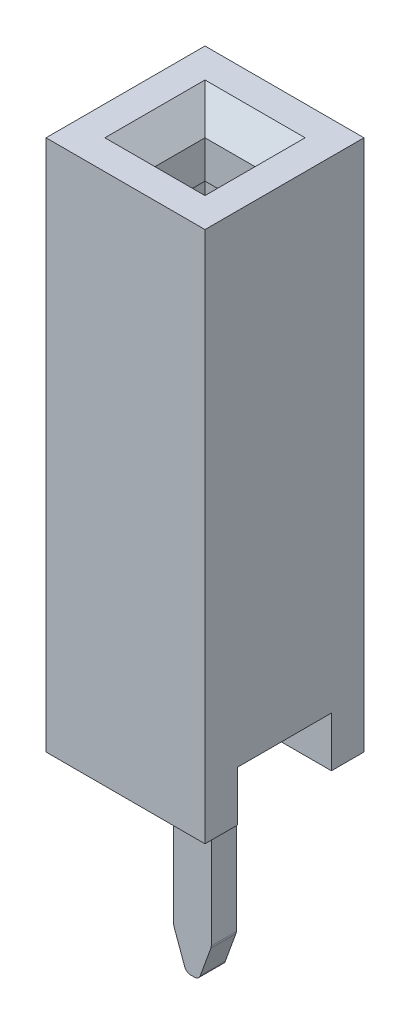
from build123d import *

# Parameters (mm, degrees)
SKETCH3_W           = 2.54
SKETCH3_H           = 2.54
SKETCH3_W_2         = 0.6
SKETCH3_H_2         = 0.4
BOSS_EXTRUDE1_DEPTH = 8.5
SKETCH4_W           = 0.8
SKETCH4_H           = 0.8
CUT_EXTRUDE1_DEPTH  = 7.5
CHAMFER1_SIZE       = 0.4
CUT_EXTRUDE3_START  = -1
SKETCH5_W           = 1.6
SKETCH5_H           = 1.6
CUT_EXTRUDE3_DEPTH  = 6.5
SKETCH6_W           = 2.54
SKETCH6_H           = 1.5
CUT_EXTRUDE4_DEPTH  = 0.8
BOSS_EXTRUDE2_START = 1
SKETCH7_W           = 0.6
SKETCH7_H           = 0.4
BOSS_EXTRUDE2_DEPTH = 4
CHAMFER2_SIZE       = 0.2
CHAMFER2_SIZE2      = 0.549495484
FILLET1_R           = 0.1


with BuildPart() as part:
    # Sketch3 → Boss-Extrude1 (new body)
    with BuildSketch(Plane(origin=(0, 0, 0), x_dir=(1, 0, 0), z_dir=(0, 1, 0))):
        Rectangle(SKETCH3_W, SKETCH3_H)
        Rectangle(SKETCH3_W_2, SKETCH3_H_2, mode=Mode.SUBTRACT)
    extrude(amount=BOSS_EXTRUDE1_DEPTH)

    # Sketch4 → Cut-Extrude1 (cut)
    with BuildSketch(Plane(origin=(0, 8.5, 0), x_dir=(1, 0, 0), z_dir=(0, 1, 0))):
        Rectangle(SKETCH4_W, SKETCH4_H)
    extrude(amount=-CUT_EXTRUDE1_DEPTH, mode=Mode.SUBTRACT)

    # Chamfer1
    chamfer1_edges = [part.edges().sort_by_distance(p)[0] for p in [
        (0.4, 8.5, 0),
        (0, 8.5, -0.4),
        (-0.4, 8.5, 0),
        (0, 8.5, 0.4),
    ]]
    chamfer(chamfer1_edges, length=CHAMFER1_SIZE)

    # Sketch5 → Cut-Extrude3 (cut)
    with BuildSketch(Plane(origin=(0, 8.5, 0), x_dir=(1, 0, 0), z_dir=(0, 1, 0)).offset(CUT_EXTRUDE3_START)):
        Rectangle(SKETCH5_W, SKETCH5_H)
    extrude(amount=-CUT_EXTRUDE3_DEPTH, mode=Mode.SUBTRACT)

    # Sketch6 → Cut-Extrude4 (cut)
    with BuildSketch(Plane.XZ):
        Rectangle(SKETCH6_W, SKETCH6_H)
    extrude(amount=-CUT_EXTRUDE4_DEPTH, mode=Mode.SUBTRACT)


with BuildPart() as body_2:
    # Sketch7 → Boss-Extrude2 (new body)
    with BuildSketch(Plane(origin=(0, 0, 0), x_dir=(1, 0, 0), z_dir=(0, 1, 0)).offset(BOSS_EXTRUDE2_START)):
        Rectangle(SKETCH7_W, SKETCH7_H)
    extrude(amount=-BOSS_EXTRUDE2_DEPTH)

    # Chamfer2
    chamfer2_edges = [body_2.edges().sort_by_distance(p)[0] for p in [
        (-0.3, -3, 0),
        (0.3, -3, 0),
    ]]
    chamfer2_side = [body_2.faces().sort_by_distance(p)[0] for p in [
        (0, -3, 0),
    ]]
    chamfer(chamfer2_edges, length=CHAMFER2_SIZE, length2=CHAMFER2_SIZE2, reference=chamfer2_side[0])

    # Fillet1
    fillet1_edges = [body_2.edges().sort_by_distance(p)[0] for p in [
        (-0.3, -2.450504516, 0),
        (0.1, -3, 0),
        (-0.1, -3, 0),
        (0.3, -2.450504516, 0),
    ]]
    fillet(fillet1_edges, radius=FILLET1_R)


solid = Compound([part.part, body_2.part])
